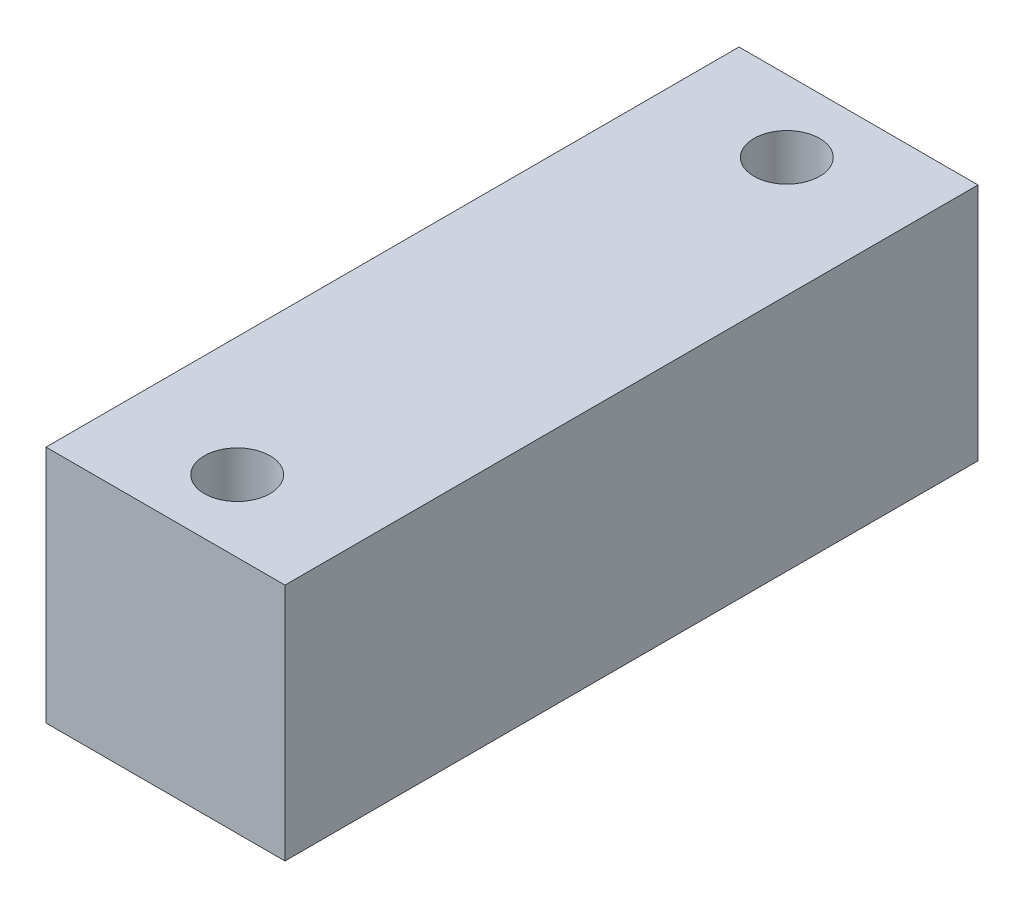
from build123d import *

# Parameters (mm, degrees)
SKETCH_1_W          = 20
SKETCH_1_H          = 20
EXTRUDE_1_DEPTH     = 58
SKETCH_2_R          = 2.75
CUT_EXTRUDE_1_DEPTH = 63.161081072


with BuildPart() as part:
    # 草图1 → 凸台-拉伸1 (new body)
    with BuildSketch(Plane.XY):
        Rectangle(SKETCH_1_W, SKETCH_1_H)
    extrude(amount=EXTRUDE_1_DEPTH)

    # 草图2 → 切除-拉伸1 (cut, through all)
    with BuildSketch(Plane(origin=(0, 10, 0), x_dir=(1, 0, 0), z_dir=(0, 1, 0))):
        with Locations(Location((0, -6, 0), (0, 0, 270))):
            Circle(SKETCH_2_R)
        with Locations(Location((0, -52, 0), (0, 0, 90))):
            Circle(SKETCH_2_R)
    extrude(amount=-CUT_EXTRUDE_1_DEPTH, mode=Mode.SUBTRACT)


solid = part.part
